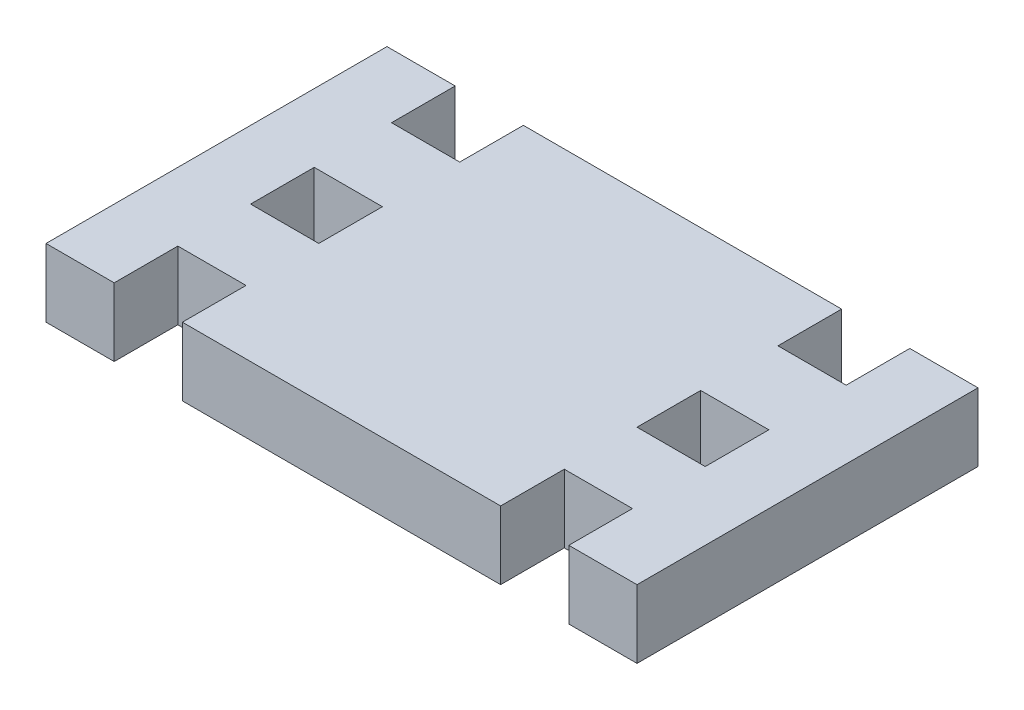
from build123d import *

# Parameters (mm, degrees)
SKETCH1_W           = 3
SKETCH1_H           = 2.8
BOSS_EXTRUDE1_DEPTH = 3


with BuildPart() as part:
    # Sketch1 → Boss-Extrude1 (new body)
    with BuildSketch(Plane(origin=(0, 0, 0), x_dir=(1, 0, 0), z_dir=(0, 1, 0))):
        Polygon((-10, -6.977624818), (-7, -6.977624818), (-7, -9.777624818), (7, -9.777624818), (7, -6.977624818), (10, -6.977624818), (10, -9.777624818), (13, -9.777624818), (13, 5.222375182), (10, 5.222375182), (10, 2.422375182), (7, 2.422375182), (7, 5.222375182), (-7, 5.222375182), (-7, 2.422375182), (-10, 2.422375182), (-10, 5.222375182), (-13, 5.222375182), (-13, -9.777624818), (-10, -9.777624818), align=None)
        with Locations((-8.5, -2.377624818)):
            Rectangle(SKETCH1_W, SKETCH1_H, mode=Mode.SUBTRACT)
        with Locations((8.5, -2.377624818)):
            Rectangle(SKETCH1_W, SKETCH1_H, mode=Mode.SUBTRACT)
    extrude(amount=BOSS_EXTRUDE1_DEPTH)


solid = part.part
